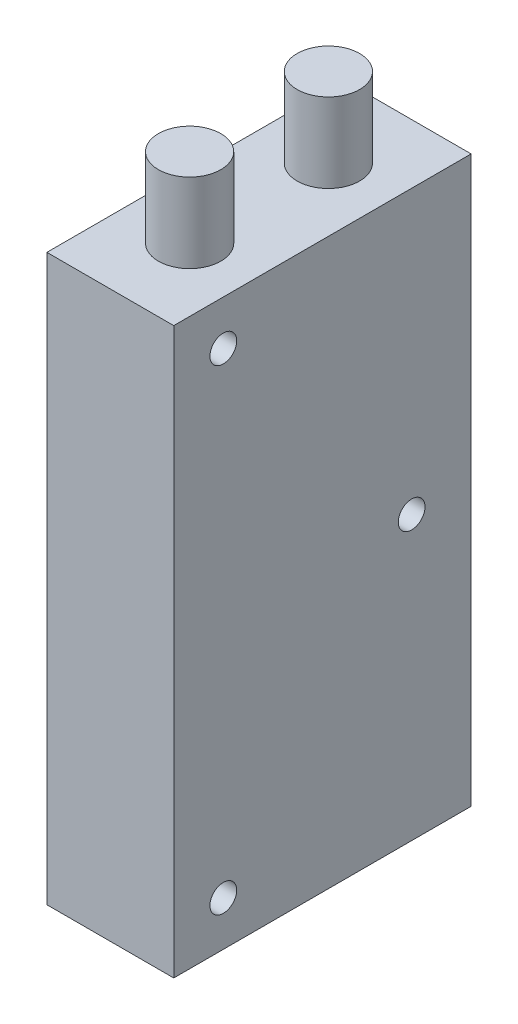
from build123d import *

# Parameters (mm, degrees)
CASE_SKETCH_W  = 30
CASE_SKETCH_H  = 57
CASE_SKETCH_R  = 1.35
CASE_2_DEPTH   = 12.8
PORTS_START    = 28.5
PORTS_SKETCH_R = 3.15
PORTS_DEPTH    = 8


with BuildPart() as part:
    # Case Sketch → Case 2 (new body)
    with BuildSketch(Plane(origin=(0, 0, 0), x_dir=(0, 0, -1), z_dir=(1, 0, 0))):
        with Locations((72, 0)):
            Rectangle(CASE_SKETCH_W, CASE_SKETCH_H)
        with Locations((62, -24)):
            Circle(CASE_SKETCH_R, mode=Mode.SUBTRACT)
        with Locations((62, 24)):
            Circle(CASE_SKETCH_R, mode=Mode.SUBTRACT)
        with Locations((81, 0)):
            Circle(CASE_SKETCH_R, mode=Mode.SUBTRACT)
    extrude(amount=-CASE_2_DEPTH)

    # Ports Sketch → Ports (add)
    with BuildSketch(Plane(origin=(0, 0, 0), x_dir=(1, 0, 0), z_dir=(0, 1, 0)).offset(PORTS_START)):
        with Locations((-6.4, 65)):
            Circle(PORTS_SKETCH_R)
        with Locations((-6.4, 79)):
            Circle(PORTS_SKETCH_R)
    extrude(amount=PORTS_DEPTH)


solid = part.part
